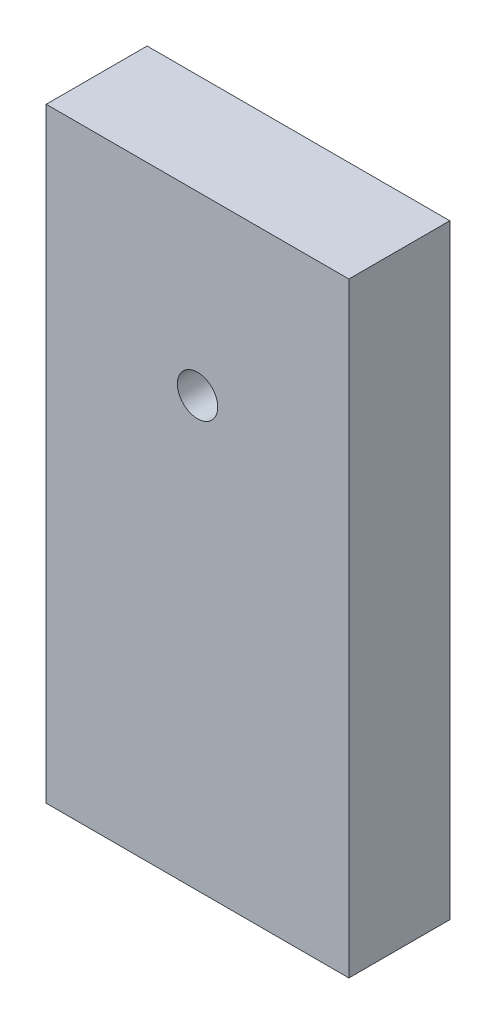
from build123d import *

# Parameters (mm, degrees)
ESQUISSE1_W             = 30
ESQUISSE1_H             = 60
BOSS_EXTRU_1_DEPTH      = 10
ESQUISSE2_R             = 2
ENL_V_MAT_EXTRU_1_DEPTH = 36


with BuildPart() as part:
    # Esquisse1 → Boss.-Extru.1 (new body)
    with BuildSketch(Plane.XY):
        Rectangle(ESQUISSE1_W, ESQUISSE1_H)
    extrude(amount=BOSS_EXTRU_1_DEPTH)

    # Esquisse2 → Enlèv. mat.-Extru.1 (cut, through all)
    with BuildSketch(Plane.XY.offset(10)):
        with Locations((0, 12.5)):
            Circle(ESQUISSE2_R)
    extrude(amount=-ENL_V_MAT_EXTRU_1_DEPTH, mode=Mode.SUBTRACT)


solid = part.part
